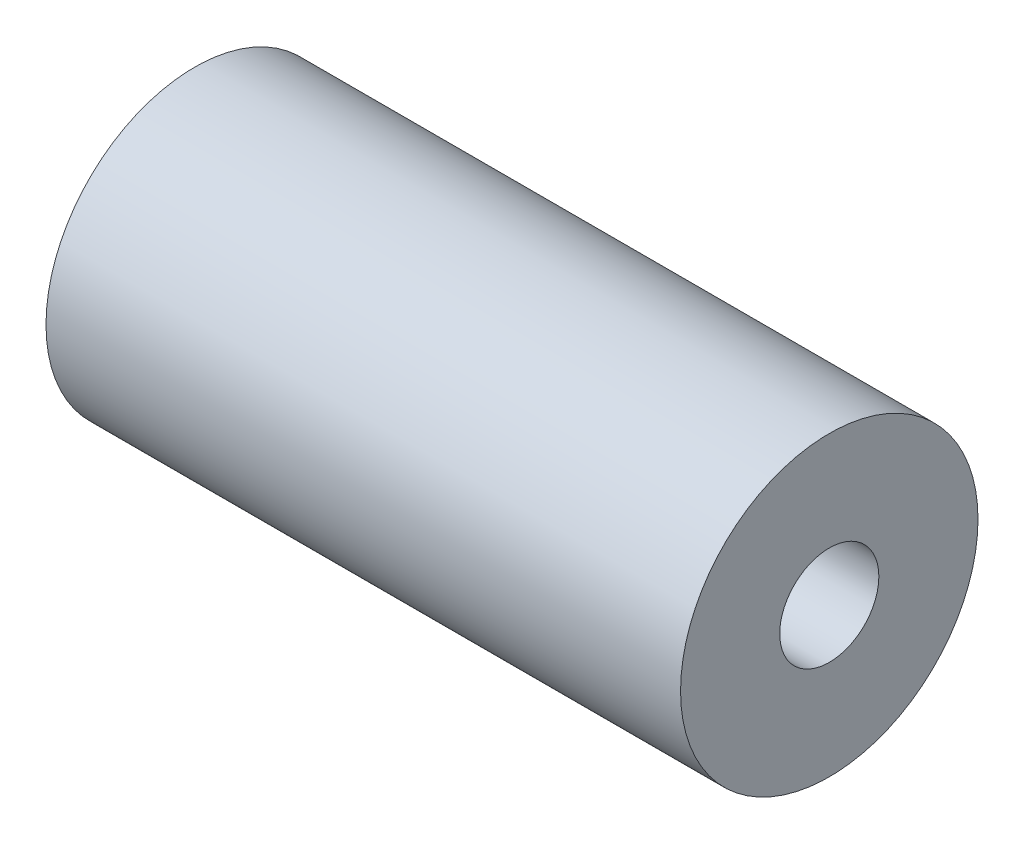
from build123d import *

# Parameters (mm, degrees)
ESQUISSE1_W                      = 32
ESQUISSE1_H                      = 7.5
ESQUISSE2_R                      = 2.5
ENL_V_MAT_EXTRU_1_DEPTH          = 22
ESQUISSE4_R                      = 4
ENL_V_MAT_EXTRU_2_DEPTH          = 6
D_GAGEMENT_M1_41_D               = 1.6
D_GAGEMENT_M1_41_DEPTH           = 6
D_GAGEMENT_M1_41_TIP             = 0.480688495
D_GAGEMENT_M1_41_ON_FACE_2_D     = 1.6
D_GAGEMENT_M1_41_ON_FACE_2_DEPTH = 6
D_GAGEMENT_M1_41_ON_FACE_2_TIP   = 0.480688495


with BuildPart() as part:
    # Esquisse1 → Révolution2 (revolve)
    with BuildSketch(Plane.XY, mode=Mode.PRIVATE) as r_volution2_sk:
        with Locations((16, 3.75)):
            Rectangle(ESQUISSE1_W, ESQUISSE1_H)
    revolve(r_volution2_sk.sketch.rotate(Axis((0, 7.5, 0), (1, 0, 0)), 270), axis=Axis((0, 7.5, 0), (1, 0, 0)))

    # Esquisse2 → Enlèv. mat.-Extru.1 (cut)
    with BuildSketch(Plane(origin=(32, 0, 0), x_dir=(0, 0, -1), z_dir=(1, 0, 0))):
        with Locations((0, 7.5)):
            Circle(ESQUISSE2_R)
    extrude(amount=-ENL_V_MAT_EXTRU_1_DEPTH, mode=Mode.SUBTRACT)

    # Esquisse4 → Enlèv. mat.-Extru.2 (cut)
    with BuildSketch(Plane.ZY):
        with Locations((0, 7.5)):
            Circle(ESQUISSE4_R)
    extrude(amount=-ENL_V_MAT_EXTRU_2_DEPTH, mode=Mode.SUBTRACT)

    # Dégagement M1.41
    with Locations(Plane(origin=(21.894837685, 0.022480062, -0.580254755), x_dir=(0, 0.077367300627, -0.997002658368), z_dir=(0, -0.997002658368, -0.077367300627))):
        with Locations((0, 0)):
            Hole(D_GAGEMENT_M1_41_D / 2, depth=D_GAGEMENT_M1_41_DEPTH)
            with Locations((0, 0, -(D_GAGEMENT_M1_41_DEPTH + D_GAGEMENT_M1_41_TIP / 2))):  # 118° drill point
                Cone(0, D_GAGEMENT_M1_41_D / 2, D_GAGEMENT_M1_41_TIP, mode=Mode.SUBTRACT)

    # Dégagement M1.41 on face 2
    with Locations(Plane(origin=(12.788839851, 0.005106148, -0.276705898), x_dir=(0, 0.036894006807, -0.999319184376), z_dir=(0, -0.999319184376, -0.036894006807))):
        with Locations((0, 0)):
            Hole(D_GAGEMENT_M1_41_ON_FACE_2_D / 2, depth=D_GAGEMENT_M1_41_ON_FACE_2_DEPTH)
            with Locations((0, 0, -(D_GAGEMENT_M1_41_ON_FACE_2_DEPTH + D_GAGEMENT_M1_41_ON_FACE_2_TIP / 2))):  # 118° drill point
                Cone(0, D_GAGEMENT_M1_41_ON_FACE_2_D / 2, D_GAGEMENT_M1_41_ON_FACE_2_TIP, mode=Mode.SUBTRACT)


solid = part.part
